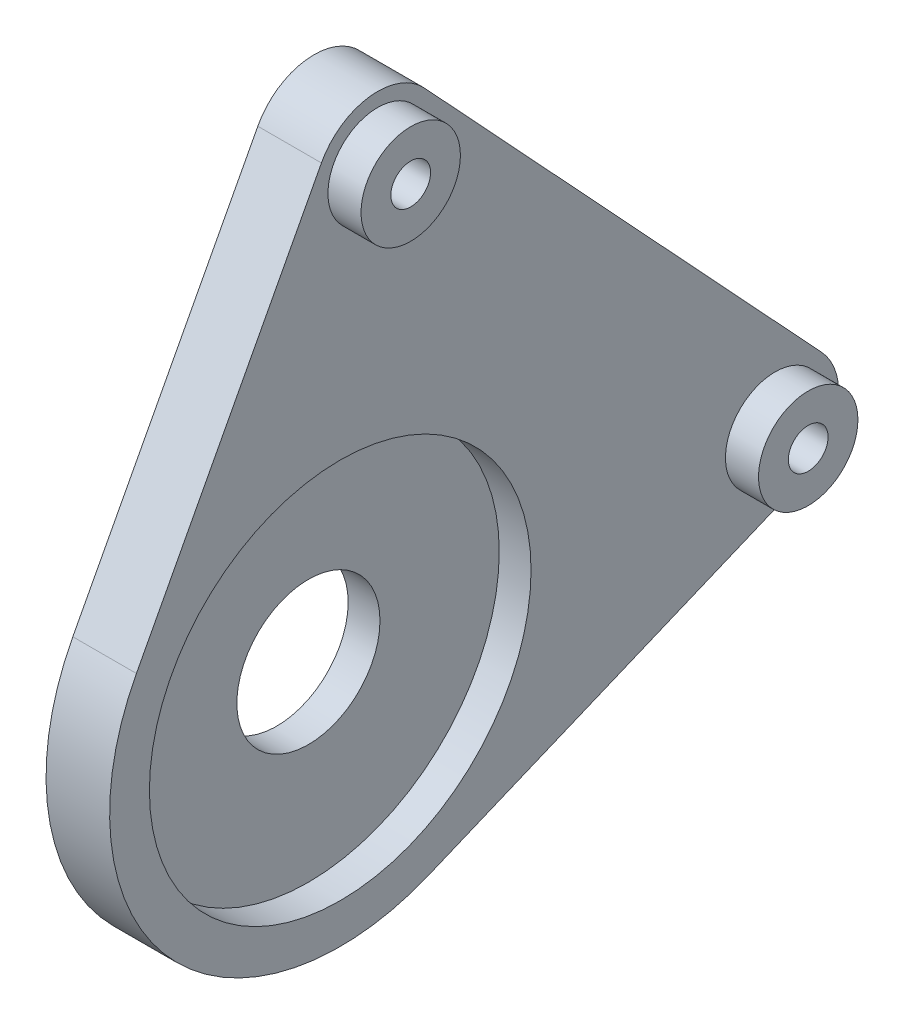
from build123d import *

# Parameters (mm, degrees)
SKETCH1_R           = 12
SKETCH1_R_2         = 1.25
BOSS_EXTRUDE1_DEPTH = 4
SKETCH1_3_R         = 3.125
SKETCH1_3_R_2       = 1.25
BOSS_EXTRUDE2_DEPTH = 6.08
SKETCH1_4_R         = 12
SKETCH1_4_R_2       = 4.5
BOSS_EXTRUDE3_DEPTH = 2


with BuildPart() as part:
    # Sketch1 → Boss-Extrude1 (new body)
    with BuildSketch(Plane(origin=(0, 0, 0), x_dir=(0, 0, -1), z_dir=(1, 0, 0))):
        with BuildLine():
            Line((30.280045487, 2.723019178), (5.283250541, 29.620276026))
            ThreePointArc((5.283250541, 29.620276026), (1.830502506, 30.862957549), (-1.182334937, 28.768074042))
            Line((-1.182334937, 28.768074042), (-12.816332467, 6.781712327))
            ThreePointArc((-12.816332467, 6.781712327), (-10.716910889, -9.767180811), (5.566727605, -13.388858942))
            Line((5.566727605, -13.388858942), (28.885648995, -3.693478329))
            ThreePointArc((28.885648995, -3.693478329), (31.258767947, -0.849431066), (30.280045487, 2.723019178))
        make_face()
        Circle(SKETCH1_R, mode=Mode.SUBTRACT)
        with Locations((2.353205054, 26.897256848)):
            Circle(SKETCH1_R_2, mode=Mode.SUBTRACT)
        with Locations((27.35, 0)):
            Circle(SKETCH1_R_2, mode=Mode.SUBTRACT)
    extrude(amount=BOSS_EXTRUDE1_DEPTH)

    # Sketch1<3> → Boss-Extrude2 (add)
    # profile 1 of 2: a face of its own
    with BuildSketch(Plane(origin=(0, 0, 0), x_dir=(0, 0, -1), z_dir=(1, 0, 0))):
        with Locations((2.353205054, 26.897256848)):
            Circle(SKETCH1_3_R)
        with Locations((2.353205054, 26.897256848)):
            Circle(SKETCH1_3_R_2, mode=Mode.SUBTRACT)
    # profile 2 of 2: a face of its own
    with BuildSketch(Plane(origin=(0, 0, 0), x_dir=(0, 0, -1), z_dir=(1, 0, 0))):
        with Locations((27.35, 0)):
            Circle(SKETCH1_3_R)
        with Locations((27.35, 0)):
            Circle(SKETCH1_3_R_2, mode=Mode.SUBTRACT)
    extrude(amount=BOSS_EXTRUDE2_DEPTH)

    # Sketch1<4> → Boss-Extrude3 (add)
    with BuildSketch(Plane(origin=(0, 0, 0), x_dir=(0, 0, -1), z_dir=(1, 0, 0))):
        Circle(SKETCH1_4_R)
        Circle(SKETCH1_4_R_2, mode=Mode.SUBTRACT)
    extrude(amount=BOSS_EXTRUDE3_DEPTH)


solid = part.part
